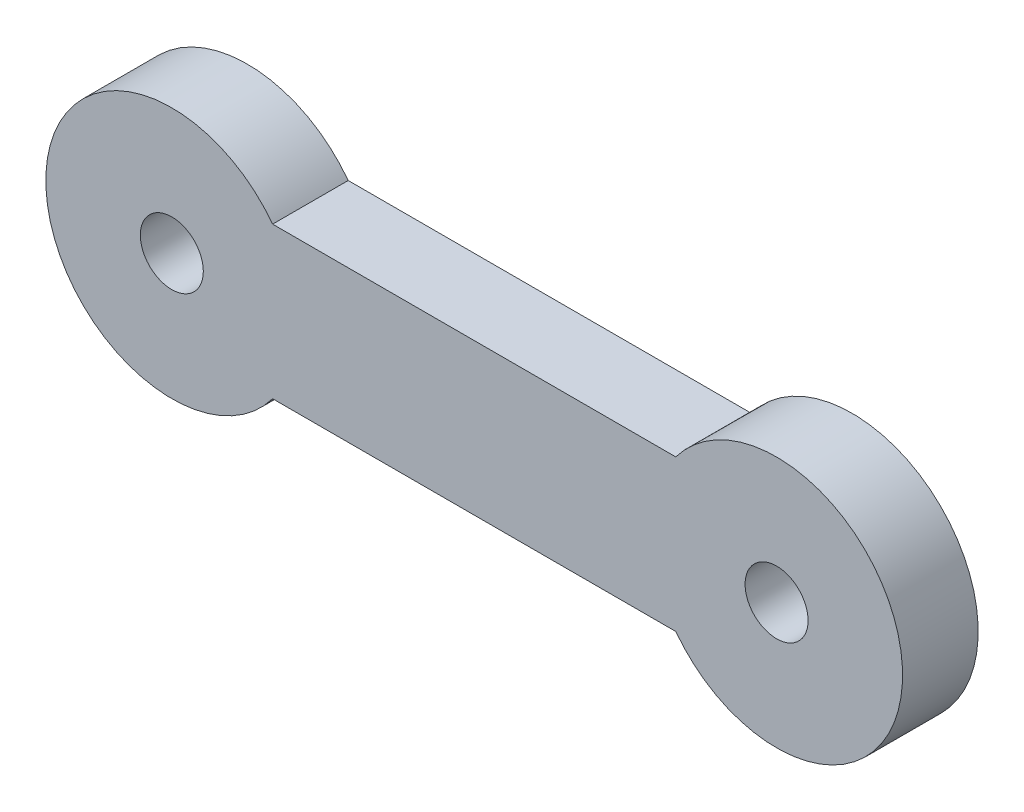
from build123d import *

# Parameters (mm, degrees)
SKETCH2_R           = 1.25
BOSS_EXTRUDE1_DEPTH = 3


with BuildPart() as part:
    # Sketch2 → Boss-Extrude1 (new body)
    with BuildSketch(Plane.XY):
        with BuildLine():
            Line((2.693779904, 3), (18.693779904, 3))
            ThreePointArc((18.693779904, 3), (27.693779904, 0), (18.693779904, -3))
            Line((18.693779904, -3), (2.693779904, -3))
            ThreePointArc((2.693779904, -3), (-6.306220096, 0), (2.693779904, 3))
        make_face()
        with Locations((-1.306220096, 0)):
            Circle(SKETCH2_R, mode=Mode.SUBTRACT)
        with Locations((22.693779904, 0)):
            Circle(SKETCH2_R, mode=Mode.SUBTRACT)
    extrude(amount=BOSS_EXTRUDE1_DEPTH)


solid = part.part
